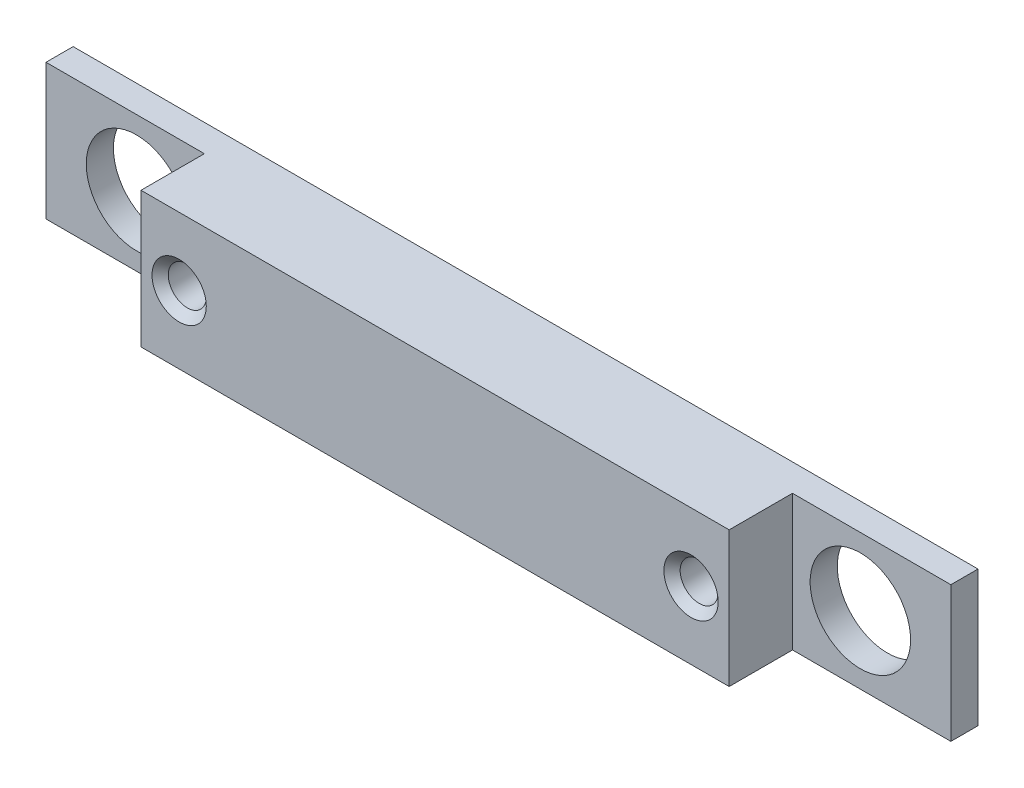
from build123d import *

# Parameters (mm, degrees)
SKETCH1_W                       = 100
SKETCH1_H                       = 15
BOSS_EXTRUDE1_DEPTH             = 5
M5X0_8_TAPPED_HOLE1_D           = 4.2
M5X0_8_TAPPED_HOLE1_DEPTH       = 12.4
M5X0_8_TAPPED_HOLE1_CSINK_D     = 6
M5X0_8_TAPPED_HOLE1_CSINK_ANGLE = 90
M5X0_8_TAPPED_HOLE1_TIP         = 1.2618073
SKETCH6_R                       = 5.5499
CUT_EXTRUDE1_DEPTH              = 52.53882032
CUT_EXTRUDE2_START              = -3
SKETCH7_W                       = 17.5
SKETCH7_H                       = 15
CUT_EXTRUDE2_DEPTH              = 49.53882032


with BuildPart() as part:
    # Sketch1 → Boss-Extrude1 (new, symmetric)
    with BuildSketch(Plane.XY):
        Rectangle(SKETCH1_W, SKETCH1_H)
    extrude(amount=BOSS_EXTRUDE1_DEPTH, both=True)

    # M5x0.8 Tapped Hole1
    with Locations(Plane.XY.offset(5)):
        with Locations((-28.2845, 0), (28.2845, 0)):
            CounterSinkHole(M5X0_8_TAPPED_HOLE1_D / 2, M5X0_8_TAPPED_HOLE1_CSINK_D / 2, depth=M5X0_8_TAPPED_HOLE1_DEPTH, counter_sink_angle=M5X0_8_TAPPED_HOLE1_CSINK_ANGLE)
            with Locations((0, 0, -(M5X0_8_TAPPED_HOLE1_DEPTH + M5X0_8_TAPPED_HOLE1_TIP / 2))):  # 118° drill point
                Cone(0, M5X0_8_TAPPED_HOLE1_D / 2, M5X0_8_TAPPED_HOLE1_TIP, mode=Mode.SUBTRACT)

    # Sketch6 → Cut-Extrude1 (cut, through all)
    with BuildSketch(Plane(origin=(0, 0, -5), x_dir=(-1, 0, 0), z_dir=(0, 0, -1))):
        with Locations((40, 0)):
            Circle(SKETCH6_R)
    cut_extrude1 = extrude(amount=-CUT_EXTRUDE1_DEPTH, mode=Mode.SUBTRACT)

    # Sketch7 → Cut-Extrude2 (cut, through all)
    with BuildSketch(Plane(origin=(0, 0, -5), x_dir=(-1, 0, 0), z_dir=(0, 0, -1)).offset(CUT_EXTRUDE2_START)):
        with Locations((41.25, 0)):
            Rectangle(SKETCH7_W, SKETCH7_H)
    cut_extrude2 = extrude(amount=-CUT_EXTRUDE2_DEPTH, mode=Mode.SUBTRACT)

    # Mirror1: Cut-Extrude1, Cut-Extrude2 across plane
    add(cut_extrude1.mirror(Plane(origin=(0, 0, 0), x_dir=(0, 0, 1), z_dir=(1, 0, 0))), mode=Mode.SUBTRACT)
    add(cut_extrude2.mirror(Plane(origin=(0, 0, 0), x_dir=(0, 0, 1), z_dir=(1, 0, 0))), mode=Mode.SUBTRACT)


solid = part.part
